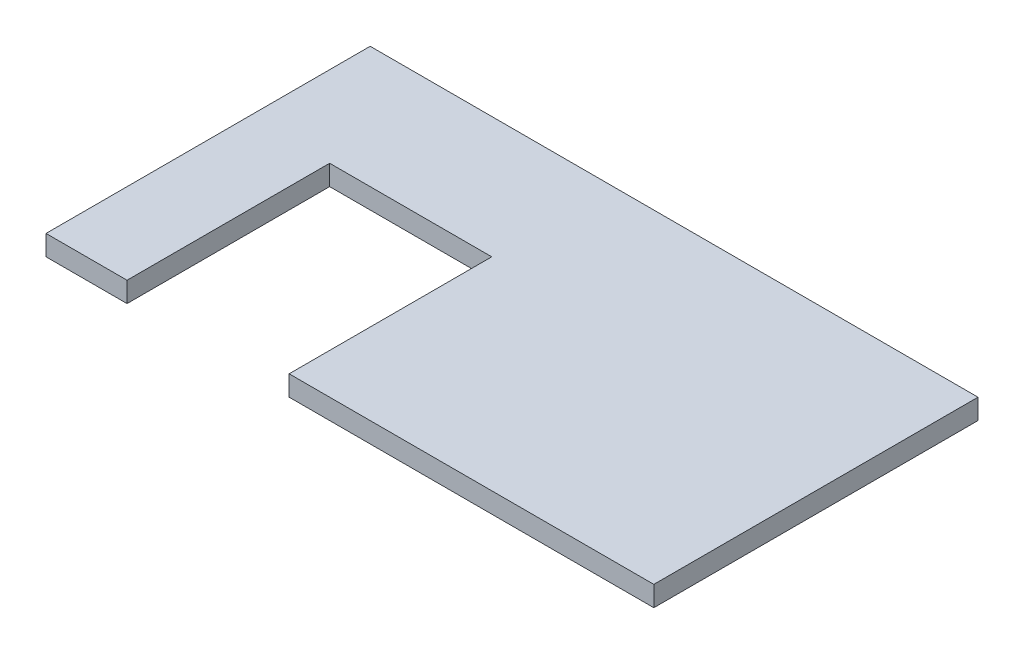
from build123d import *

# Parameters (mm, degrees)
BOSS_EXTRUDE1_DEPTH = 5


with BuildPart() as part:
    # Sketch1 → Boss-Extrude1 (new body)
    with BuildSketch(Plane(origin=(0, 0, 0), x_dir=(1, 0, 0), z_dir=(0, 1, 0))):
        Polygon((-15, -40), (75, -40), (75, 40), (-75, 40), (-75, -40), (-55, -40), (-55, 10), (-15, 10), align=None)
    extrude(amount=BOSS_EXTRUDE1_DEPTH)


solid = part.part
